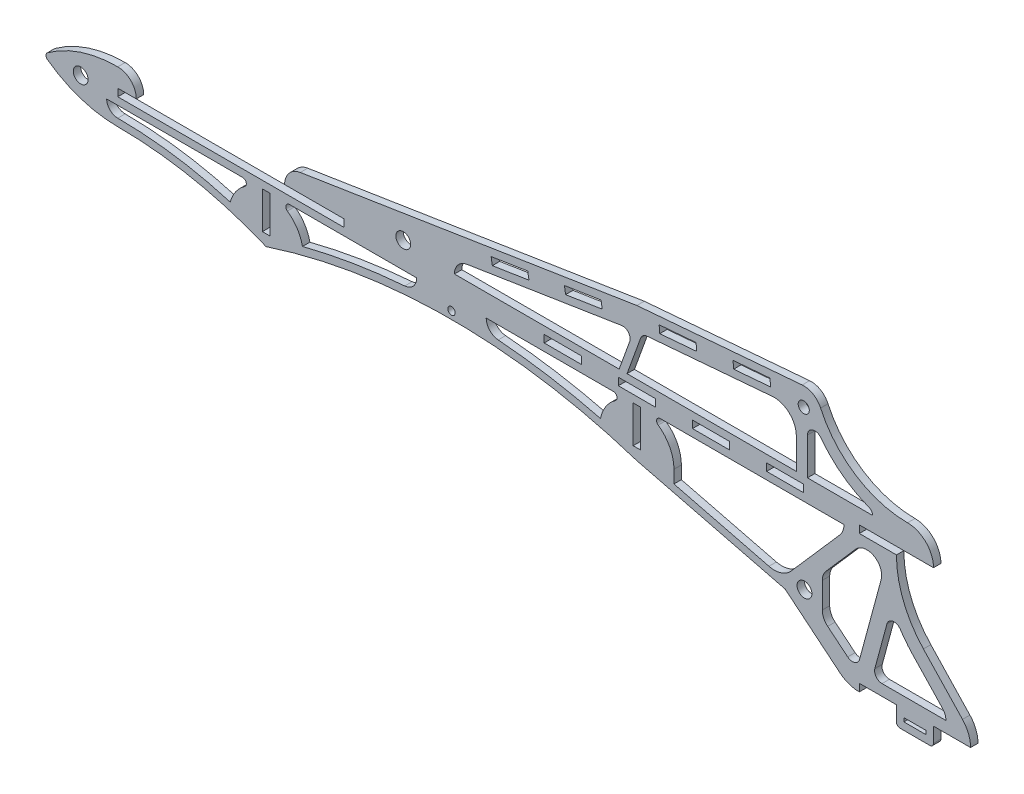
from build123d import *

# Parameters (mm, degrees)
SKETCH1_R           = 2
SKETCH1_R_2         = 1.5
SKETCH1_R_3         = 0.999995252
SKETCH1_W           = 2
SKETCH1_H           = 10
SKETCH1_W_2         = 6
SKETCH1_H_2         = 1
SKETCH1_W_3         = 10
SKETCH1_H_3         = 2
BOSS_EXTRUDE1_DEPTH = 2


with BuildPart() as part:
    # Sketch1 → Boss-Extrude1 (new body)
    with BuildSketch(Plane.XY):
        with BuildLine():
            Line((25, 2), (20, 2))
            Line((20, 2), (20, 0))
            Line((20, 0), (81, 0))
            Line((81, 0), (81, 2))
            Line((81, 2), (65, 2))
            ThreePointArc((65, 2), (66.199138226, 5.24860736), (69.221379911, 6.939003012))
            Line((69.221379911, 6.939003012), (160, 21.25))
            Line((160, 21.25), (204.582849115, 24.982568127))
            ThreePointArc((204.582849115, 24.982568127), (207.525828031, 24.315112137), (209.548736462, 22.075812274))
            ThreePointArc((209.548736462, 22.075812274), (219.060470979, 11.094065968), (233, 7))
            ThreePointArc((233, 7), (237.949747468, 4.949747468), (240, 0))
            Line((240, 0), (220, 0))
            Line((220, 0), (220, -2))
            Line((220, -2), (230, -2))
            ThreePointArc((230, -2), (231.885664581, -11.859196198), (237.276483238, -20.326696111))
            Line((237.276483238, -20.326696111), (247.82118659, -31.512397))
            ThreePointArc((247.82118659, -31.512397), (249.435371299, -34.047839158), (250, -37))
            Line((250, -37), (240, -37))
            Line((240, -37), (240, -41))
            ThreePointArc((240, -41), (239.707106781, -41.707106781), (239, -42))
            Line((239, -42), (231, -42))
            ThreePointArc((231, -42), (230.292893219, -41.707106781), (230, -41))
            Line((230, -41), (230, -37))
            Line((230, -37), (220.000007865, -37))
            Line((220.000007865, -37), (220.000007865, -39))
            Line((220.000007865, -39), (219.870131034, -39))
            ThreePointArc((219.870131034, -39), (217.168606934, -38.530057605), (214.784473011, -37.175441885))
            Line((214.784473011, -37.175441885), (200.000007865, -25))
            Line((200.000007865, -25), (160, -15))
            ThreePointArc((160, -15), (110, -7), (60, -15))
            ThreePointArc((60, -15), (40.396078054, -9.019609728), (20, -7))
            ThreePointArc((20, -7), (10.034517702, -5.41243098), (1.055638849, -0.806896552))
            ThreePointArc((1.055638849, -0.806896552), (0.646331624, 0), (1.055638849, 0.806896552))
            ThreePointArc((1.055638849, 0.806896552), (10.034517702, 5.41243098), (20, 7))
            ThreePointArc((20, 7), (23.535533906, 5.535533906), (25, 2))
        make_face()
        with Locations((10, 0)):
            Circle(SKETCH1_R, mode=Mode.SUBTRACT)
        with Locations((205, 20)):
            Circle(SKETCH1_R_2, mode=Mode.SUBTRACT)
        with Locations((110, -5.003081664)):
            Circle(SKETCH1_R_3, mode=Mode.SUBTRACT)
        with Locations((97, 5)):
            Circle(SKETCH1_R, mode=Mode.SUBTRACT)
        with Locations((205.2, -22.5)):
            Circle(SKETCH1_R, mode=Mode.SUBTRACT)
        with BuildLine():
            Line((66.32455532, -2), (100.63531967, -2))
            ThreePointArc((100.63531967, -2), (99.70444241, -4.376890478), (97.406972045, -5.489441931))
            ThreePointArc((97.406972045, -5.489441931), (83.509545549, -7.177146827), (69.809337188, -10.056574175))
            ThreePointArc((69.809337188, -10.056574175), (68.381496484, -6.545596578), (65.749595746, -3.818181818))
            ThreePointArc((65.749595746, -3.818181818), (65.371092731, -2.698488655), (66.32455532, -2))
        make_face(mode=Mode.SUBTRACT)
        with Locations((60, -7)):
            Rectangle(SKETCH1_W, SKETCH1_H, mode=Mode.SUBTRACT)
        with BuildLine():
            Line((17, -2), (53.67544468, -2))
            ThreePointArc((53.67544468, -2), (54.628907269, -2.698488655), (54.250404254, -3.818181818))
            ThreePointArc((54.250404254, -3.818181818), (51.797261355, -6.280290329), (50.33500013, -9.433333386))
            ThreePointArc((50.33500013, -9.433333386), (35.328622555, -6.114189089), (20, -5))
            ThreePointArc((20, -5), (17.878679656, -4.121320344), (17, -2))
        make_face(mode=Mode.SUBTRACT)
        with Locations((235, -39.5)):
            Rectangle(SKETCH1_W_2, SKETCH1_H_2, mode=Mode.SUBTRACT)
        with Locations((160, -7)):
            Rectangle(SKETCH1_W, SKETCH1_H, mode=Mode.SUBTRACT)
        with BuildLine():
            Line((170, -15.438446719), (195.626465602, -21.84506186))
            ThreePointArc((195.626465602, -21.84506186), (198.873506118, -21.75040587), (201.59533068, -19.977300424))
            Line((201.59533068, -19.977300424), (214.743385775, -4.964820224))
            ThreePointArc((214.743385775, -4.964820224), (215.570247155, -3.583733857), (215.858147077, -2))
            Line((215.858147077, -2), (166.32455532, -2))
            ThreePointArc((166.32455532, -2), (165.371092731, -2.698488655), (165.749595746, -3.818181818))
            ThreePointArc((165.749595746, -3.818181818), (168.874005788, -7.390008539), (170, -12))
            Line((170, -12), (170, -15.438446719))
        make_face(mode=Mode.SUBTRACT)
        with BuildLine():
            Line((119.36468033, -2), (153.67544468, -2))
            ThreePointArc((153.67544468, -2), (154.628907269, -2.698488655), (154.250404254, -3.818181818))
            ThreePointArc((154.250404254, -3.818181818), (151.618503516, -6.545596578), (150.190662812, -10.056574175))
            ThreePointArc((150.190662812, -10.056574175), (136.490454451, -7.177146827), (122.593027955, -5.489441931))
            ThreePointArc((122.593027955, -5.489441931), (120.29555759, -4.376890478), (119.36468033, -2))
        make_face(mode=Mode.SUBTRACT)
        with BuildLine():
            Line((225.879980597, -9.844071792), (220.058756659, -31.382600362))
            ThreePointArc((220.058756659, -31.382600362), (218.736154735, -32.766086526), (216.856615367, -32.404642783))
            Line((216.856615367, -32.404642783), (211.457170989, -27.95804153))
            ThreePointArc((211.457170989, -27.95804153), (210.382589597, -26.57746498), (210, -24.870320587))
            Line((210, -24.870320587), (210, -17.956008689))
            ThreePointArc((210, -17.956008689), (210.255911041, -16.54824526), (210.990898935, -15.320612934))
            Line((210.990898935, -15.320612934), (219.00942596, -6.165039937))
            ThreePointArc((219.00942596, -6.165039937), (223.906765634, -5.274169259), (225.879980597, -9.844071792))
        make_face(mode=Mode.SUBTRACT)
        with BuildLine():
            Line((155.22, 4), (158.067354896, 11.869573832))
            ThreePointArc((158.067354896, 11.869573832), (157.729169089, 13.823107559), (155.875224231, 14.525640207))
            Line((155.875224231, 14.525640207), (114.171743224, 7.95120241))
            ThreePointArc((114.171743224, 7.95120241), (111.753949876, 6.598885888), (110.794639295, 4))
            Line((110.794639295, 4), (155.22, 4))
        make_face(mode=Mode.SUBTRACT)
        with BuildLine():
            Line((162.73140024, 15.457687033), (196.499418938, 18.28481524))
            ThreePointArc((196.499418938, 18.28481524), (201.061804625, 16.721811294), (203, 12.305733488))
            Line((203, 12.305733488), (203, 4))
            Line((203, 4), (157.3468873, 4))
            Line((157.3468873, 4), (161.017577964, 14.145124952))
            ThreePointArc((161.017577964, 14.145124952), (161.682196092, 15.052484435), (162.73140024, 15.457687033))
        make_face(mode=Mode.SUBTRACT)
        with BuildLine():
            Line((206, 13.981517971), (206, 4))
            Line((206, 4), (223.586196304, 4))
            ThreePointArc((223.586196304, 4), (223.320669931, 4.852100267), (222.618096484, 5.402527076))
            ThreePointArc((222.618096484, 5.402527076), (215.414646092, 9.369582641), (209.598579041, 15.18341025))
            ThreePointArc((209.598579041, 15.18341025), (207.366422097, 15.878510075), (206, 13.981517971))
        make_face(mode=Mode.SUBTRACT)
        Polygon((166, 19.745335237), (175.965136254, 20.579637008), (176.131996608, 18.586609757), (166.166860354, 17.752307987), align=None, mode=Mode.SUBTRACT)
        Polygon((150.334018075, 17.701484711), (140.45601205, 16.144244533), (140.767460085, 14.168643328), (150.64546611, 15.725883506), align=None, mode=Mode.SUBTRACT)
        Polygon((121.011448036, 11.054162973), (120.7, 13.029764178), (130.578006025, 14.587004355), (130.88945406, 12.61140315), align=None, mode=Mode.SUBTRACT)
        Polygon((186.097132862, 19.420911528), (185.930272507, 21.413938779), (195.895408761, 22.24824055), (196.062269115, 20.255213299), align=None, mode=Mode.SUBTRACT)
        with BuildLine():
            Line((227.433137345, -19.428406141), (224.17644118, -31.47818195))
            ThreePointArc((224.17644118, -31.47818195), (224.519144651, -33.215805062), (226.107167967, -34))
            Line((226.107167967, -34), (243.359060381, -34))
            ThreePointArc((243.359060381, -34), (243.112035325, -32.708429631), (242.405829515, -31.599173688))
            Line((242.405829515, -31.599173688), (234.365889943, -23.070497611))
            ThreePointArc((234.365889943, -23.070497611), (232.608526335, -21.034670167), (231.035971848, -18.852929436))
            ThreePointArc((231.035971848, -18.852929436), (229.048405235, -17.975259461), (227.433137345, -19.428406141))
        make_face(mode=Mode.SUBTRACT)
        with Locations((140, 1)):
            Rectangle(SKETCH1_W_3, SKETCH1_H_3, mode=Mode.SUBTRACT)
        with Locations((160, 1)):
            Rectangle(SKETCH1_W_3, SKETCH1_H_3, mode=Mode.SUBTRACT)
        with Locations((180, 1)):
            Rectangle(SKETCH1_W_3, SKETCH1_H_3, mode=Mode.SUBTRACT)
        with Locations((200, 1)):
            Rectangle(SKETCH1_W_3, SKETCH1_H_3, mode=Mode.SUBTRACT)
    extrude(amount=BOSS_EXTRUDE1_DEPTH)


solid = part.part
